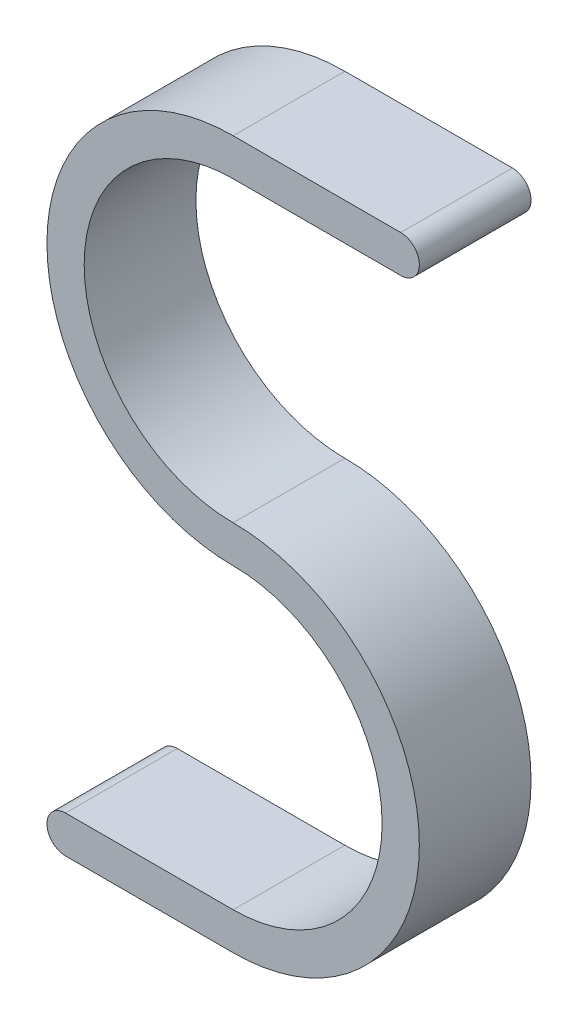
from build123d import *

# Parameters (mm, degrees)
Y_KSEKLIK_EKSTR_ZYON2_DEPTH = 15


with BuildPart() as part:
    # Çizim3 → Yükseklik-Ekstrüzyon2 (new body)
    with BuildSketch(Plane.XY):
        with BuildLine():
            Line((0, 45), (22.5, 45))
            ThreePointArc((22.5, 45), (25, 42.5), (22.5, 40))
            Line((22.5, 40), (0, 40))
            ThreePointArc((0, 40), (-20, 20), (0, 0))
            ThreePointArc((0, 0), (25, -25), (0, -50))
            Line((0, -50), (-22.5, -50))
            ThreePointArc((-22.5, -50), (-25, -47.5), (-22.5, -45))
            Line((-22.5, -45), (0, -45))
            ThreePointArc((0, -45), (20, -25), (0, -5))
            ThreePointArc((0, -5), (-25, 20), (0, 45))
        make_face()
    extrude(amount=Y_KSEKLIK_EKSTR_ZYON2_DEPTH)


solid = part.part
